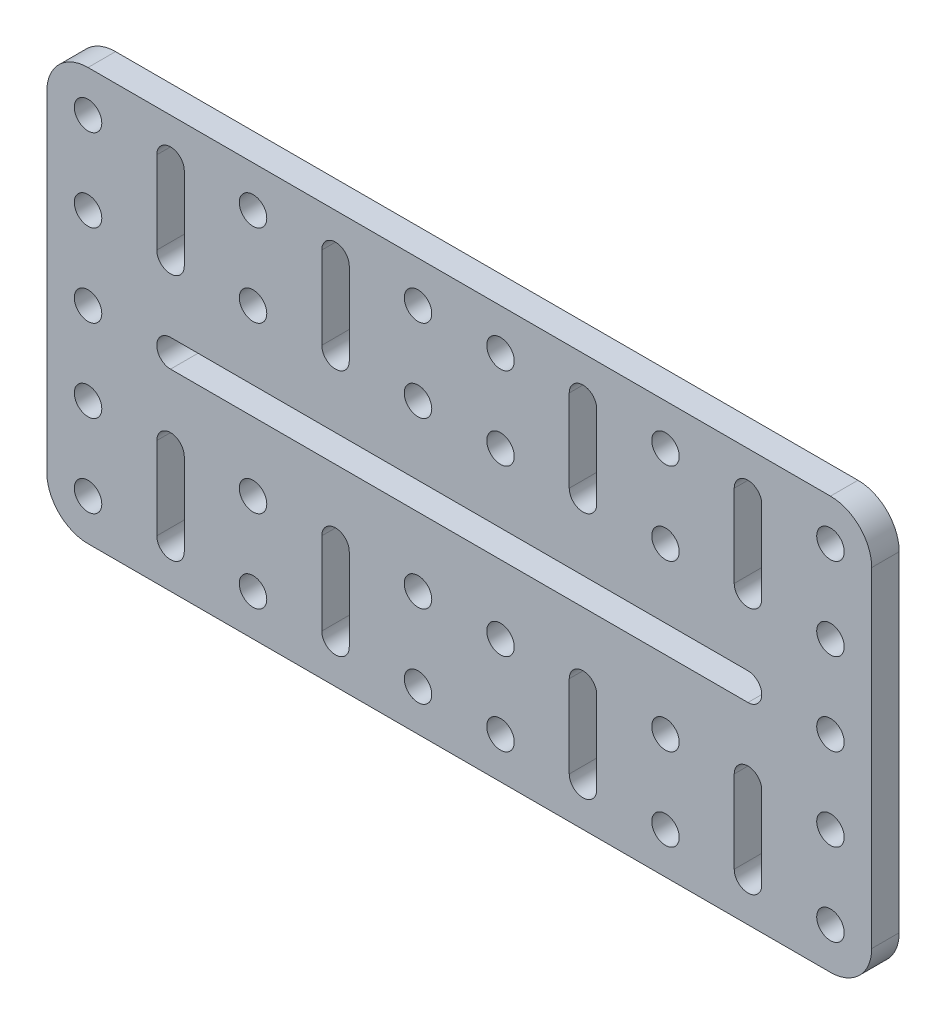
from build123d import *

# Parameters (mm, degrees)
MODEL_R                 = 1.5
SALIENTE_EXTRUIR1_DEPTH = 3


with BuildPart() as part:
    # Model → Saliente-Extruir1 (new body)
    with BuildSketch(Plane.XY):
        with BuildLine():
            Line((-105.943383637, 101.056539338), (-105.943383637, 65.056539338))
            ThreePointArc((-105.943383637, 65.056539338), (-104.625364152, 61.874558823), (-101.443383637, 60.556539338))
            Line((-101.443383637, 60.556539338), (-20.443383637, 60.556539338))
            ThreePointArc((-20.443383637, 60.556539338), (-17.261403122, 61.874558823), (-15.943383637, 65.056539338))
            Line((-15.943383637, 65.056539338), (-15.943383637, 101.056539338))
            ThreePointArc((-15.943383637, 101.056539338), (-17.261403122, 104.238519853), (-20.443383637, 105.556539338))
            Line((-20.443383637, 105.556539338), (-101.443383637, 105.556539338))
            ThreePointArc((-101.443383637, 105.556539338), (-104.625364152, 104.238519853), (-105.943383637, 101.056539338))
        make_face()
        with Locations((-101.443383637, 101.056539338)):
            Circle(MODEL_R, mode=Mode.SUBTRACT)
        with Locations((-83.443383637, 101.056539338)):
            Circle(MODEL_R, mode=Mode.SUBTRACT)
        with Locations((-65.443383637, 101.056539338)):
            Circle(MODEL_R, mode=Mode.SUBTRACT)
        with Locations((-56.443383637, 101.056539338)):
            Circle(MODEL_R, mode=Mode.SUBTRACT)
        with Locations((-38.443383637, 101.056539338)):
            Circle(MODEL_R, mode=Mode.SUBTRACT)
        with Locations((-101.443383637, 92.056539338)):
            Circle(MODEL_R, mode=Mode.SUBTRACT)
        with Locations((-83.443383637, 92.056539338)):
            Circle(MODEL_R, mode=Mode.SUBTRACT)
        with Locations((-65.443383637, 92.056539338)):
            Circle(MODEL_R, mode=Mode.SUBTRACT)
        with Locations((-56.443383637, 92.056539338)):
            Circle(MODEL_R, mode=Mode.SUBTRACT)
        with Locations((-38.443383637, 92.056539338)):
            Circle(MODEL_R, mode=Mode.SUBTRACT)
        with Locations((-101.443383637, 83.056539338)):
            Circle(MODEL_R, mode=Mode.SUBTRACT)
        with Locations((-101.443383637, 65.056539338)):
            Circle(MODEL_R, mode=Mode.SUBTRACT)
        with Locations((-83.443383637, 65.056539338)):
            Circle(MODEL_R, mode=Mode.SUBTRACT)
        with Locations((-65.443383637, 65.056539338)):
            Circle(MODEL_R, mode=Mode.SUBTRACT)
        with Locations((-56.443383637, 65.056539338)):
            Circle(MODEL_R, mode=Mode.SUBTRACT)
        with Locations((-38.443383637, 65.056539338)):
            Circle(MODEL_R, mode=Mode.SUBTRACT)
        with Locations((-20.443383637, 101.056539338)):
            Circle(MODEL_R, mode=Mode.SUBTRACT)
        with Locations((-20.443383637, 92.056539338)):
            Circle(MODEL_R, mode=Mode.SUBTRACT)
        with Locations((-20.443383637, 83.056539338)):
            Circle(MODEL_R, mode=Mode.SUBTRACT)
        with Locations((-20.443383637, 65.056539338)):
            Circle(MODEL_R, mode=Mode.SUBTRACT)
        with Locations((-101.443383637, 74.056539338)):
            Circle(MODEL_R, mode=Mode.SUBTRACT)
        with Locations((-83.443383637, 74.056539338)):
            Circle(MODEL_R, mode=Mode.SUBTRACT)
        with Locations((-65.443383637, 74.056539338)):
            Circle(MODEL_R, mode=Mode.SUBTRACT)
        with Locations((-56.443383637, 74.056539338)):
            Circle(MODEL_R, mode=Mode.SUBTRACT)
        with Locations((-38.443383637, 74.056539338)):
            Circle(MODEL_R, mode=Mode.SUBTRACT)
        with Locations((-20.443383637, 74.056539338)):
            Circle(MODEL_R, mode=Mode.SUBTRACT)
        with BuildLine():
            Line((-92.443383637, 84.556539338), (-29.443383637, 84.556539338))
            ThreePointArc((-29.443383637, 84.556539338), (-27.943383637, 83.056539338), (-29.443383637, 81.556539338))
            Line((-29.443383637, 81.556539338), (-92.443383637, 81.556539338))
            ThreePointArc((-92.443383637, 81.556539338), (-93.943383637, 83.056539338), (-92.443383637, 84.556539338))
        make_face(mode=Mode.SUBTRACT)
        with BuildLine():
            Line((-93.943383637, 74.056539338), (-93.943383637, 65.056539338))
            ThreePointArc((-93.943383637, 65.056539338), (-92.443383637, 63.556539338), (-90.943383637, 65.056539338))
            Line((-90.943383637, 65.056539338), (-90.943383637, 74.056539338))
            ThreePointArc((-90.943383637, 74.056539338), (-92.443383637, 75.556539338), (-93.943383637, 74.056539338))
        make_face(mode=Mode.SUBTRACT)
        with BuildLine():
            Line((-75.943383637, 74.056539338), (-75.943383637, 65.056539338))
            ThreePointArc((-75.943383637, 65.056539338), (-74.443383637, 63.556539338), (-72.943383637, 65.056539338))
            Line((-72.943383637, 65.056539338), (-72.943383637, 74.056539338))
            ThreePointArc((-72.943383637, 74.056539338), (-74.443383637, 75.556539338), (-75.943383637, 74.056539338))
        make_face(mode=Mode.SUBTRACT)
        with BuildLine():
            Line((-48.943383637, 74.056539338), (-48.943383637, 65.056539338))
            ThreePointArc((-48.943383637, 65.056539338), (-47.443383637, 63.556539338), (-45.943383637, 65.056539338))
            Line((-45.943383637, 65.056539338), (-45.943383637, 74.056539338))
            ThreePointArc((-45.943383637, 74.056539338), (-47.443383637, 75.556539338), (-48.943383637, 74.056539338))
        make_face(mode=Mode.SUBTRACT)
        with BuildLine():
            Line((-30.943383637, 74.056539338), (-30.943383637, 65.056539338))
            ThreePointArc((-30.943383637, 65.056539338), (-29.443383637, 63.556539338), (-27.943383637, 65.056539338))
            Line((-27.943383637, 65.056539338), (-27.943383637, 74.056539338))
            ThreePointArc((-27.943383637, 74.056539338), (-29.443383637, 75.556539338), (-30.943383637, 74.056539338))
        make_face(mode=Mode.SUBTRACT)
        with BuildLine():
            Line((-93.943383637, 101.056539338), (-93.943383637, 92.056539338))
            ThreePointArc((-93.943383637, 92.056539338), (-92.443383637, 90.556539338), (-90.943383637, 92.056539338))
            Line((-90.943383637, 92.056539338), (-90.943383637, 101.056539338))
            ThreePointArc((-90.943383637, 101.056539338), (-92.443383637, 102.556539338), (-93.943383637, 101.056539338))
        make_face(mode=Mode.SUBTRACT)
        with BuildLine():
            Line((-75.943383637, 101.056539338), (-75.943383637, 92.056539338))
            ThreePointArc((-75.943383637, 92.056539338), (-74.443383637, 90.556539338), (-72.943383637, 92.056539338))
            Line((-72.943383637, 92.056539338), (-72.943383637, 101.056539338))
            ThreePointArc((-72.943383637, 101.056539338), (-74.443383637, 102.556539338), (-75.943383637, 101.056539338))
        make_face(mode=Mode.SUBTRACT)
        with BuildLine():
            Line((-48.943383637, 101.056539338), (-48.943383637, 92.056539338))
            ThreePointArc((-48.943383637, 92.056539338), (-47.443383637, 90.556539338), (-45.943383637, 92.056539338))
            Line((-45.943383637, 92.056539338), (-45.943383637, 101.056539338))
            ThreePointArc((-45.943383637, 101.056539338), (-47.443383637, 102.556539338), (-48.943383637, 101.056539338))
        make_face(mode=Mode.SUBTRACT)
        with BuildLine():
            Line((-30.943383637, 101.056539338), (-30.943383637, 92.056539338))
            ThreePointArc((-30.943383637, 92.056539338), (-29.443383637, 90.556539338), (-27.943383637, 92.056539338))
            Line((-27.943383637, 92.056539338), (-27.943383637, 101.056539338))
            ThreePointArc((-27.943383637, 101.056539338), (-29.443383637, 102.556539338), (-30.943383637, 101.056539338))
        make_face(mode=Mode.SUBTRACT)
    extrude(amount=SALIENTE_EXTRUIR1_DEPTH)


solid = part.part
